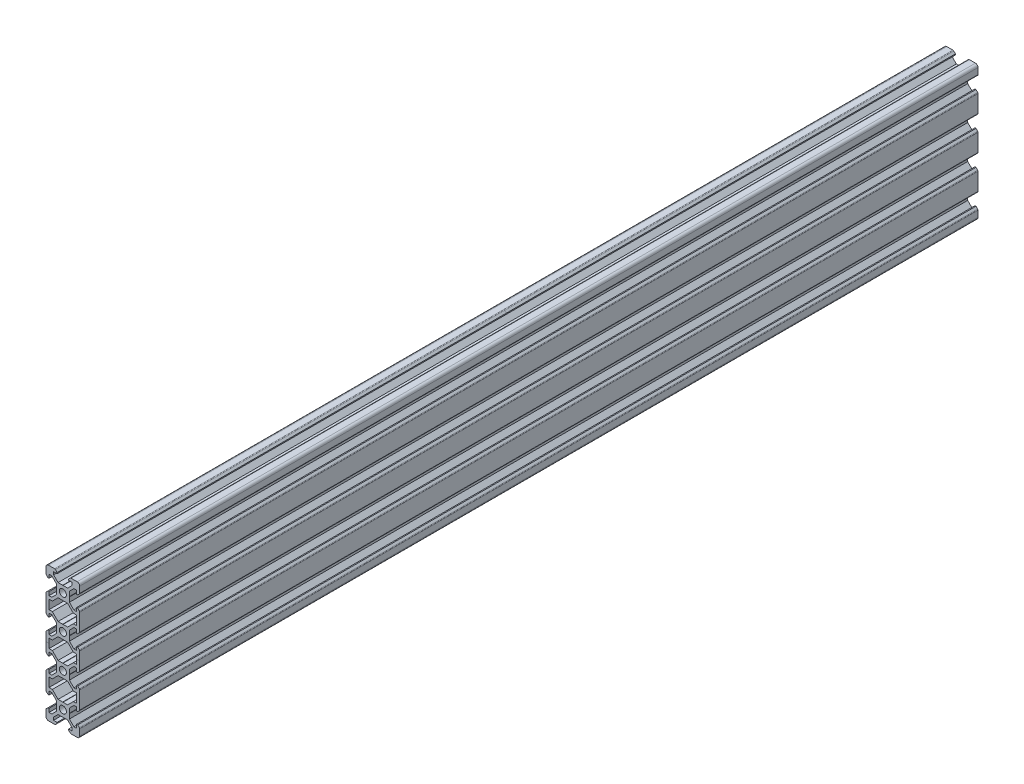
from build123d import *

# Parameters (mm, degrees)
SKETCH1_R           = 2.1
BOSS_EXTRUDE2_DEPTH = 533


with BuildPart() as part:
    # Sketch1 → Boss-Extrude2 (new body)
    with BuildSketch(Plane.XY):
        with BuildLine():
            Line((-8.5, 10), (-4.862792737, 10))
            ThreePointArc((-4.862792737, 10), (-4.598292737, 9.947387679), (-4.374060464, 9.797560464))
            Line((-4.374060464, 9.797560464), (-3.3865, 8.81))
            Line((-3.3865, 8.81), (-3.3865, 8.2))
            Line((-3.3865, 8.2), (-5.5, 8.2))
            Line((-5.5, 8.2), (-5.5, 6.561))
            Line((-5.5, 6.561), (-2.8395, 3.9005))
            Line((-2.8395, 3.9005), (-0.1, 3.9005))
            Line((-0.1, 3.9005), (0, 3.8005))
            Line((0, 3.8005), (0.1, 3.9005))
            Line((0.1, 3.9005), (2.8395, 3.9005))
            Line((2.8395, 3.9005), (5.5, 6.561))
            Line((5.5, 6.561), (5.5, 8.2))
            Line((5.5, 8.2), (3.3865, 8.2))
            Line((3.3865, 8.2), (3.3865, 8.81))
            Line((3.3865, 8.81), (4.374060464, 9.797560464))
            ThreePointArc((4.374060464, 9.797560464), (4.598292737, 9.947387679), (4.862792737, 10))
            Line((4.862792737, 10), (8.5, 10))
            ThreePointArc((8.5, 10), (9.560660172, 9.560660172), (10, 8.5))
            Line((10, 8.5), (10, 4.862792737))
            ThreePointArc((10, 4.862792737), (9.947387679, 4.598292737), (9.797560464, 4.374060464))
            Line((9.797560464, 4.374060464), (8.81, 3.3865))
            Line((8.81, 3.3865), (8.2, 3.3865))
            Line((8.2, 3.3865), (8.2, 5.5))
            Line((8.2, 5.5), (6.561, 5.5))
            Line((6.561, 5.5), (3.9005, 2.8395))
            Line((3.9005, 2.8395), (3.9005, 0.1))
            Line((3.9005, 0.1), (3.8005, 0))
            Line((3.8005, 0), (3.9005, -0.1))
            Line((3.9005, -0.1), (3.9005, -2.8395))
            Line((3.9005, -2.8395), (6.561, -5.5))
            Line((6.561, -5.5), (8.2, -5.5))
            Line((8.2, -5.5), (8.2, -3.3865))
            Line((8.2, -3.3865), (8.81, -3.3865))
            Line((8.81, -3.3865), (9.797560464, -4.374060464))
            ThreePointArc((9.797560464, -4.374060464), (9.947387679, -4.598292737), (10, -4.862792737))
            Line((10, -4.862792737), (10, -15.137207263))
            ThreePointArc((10, -15.137207263), (9.947387679, -15.401707263), (9.797560464, -15.625939536))
            Line((9.797560464, -15.625939536), (8.81, -16.6135))
            Line((8.81, -16.6135), (8.2, -16.6135))
            Line((8.2, -16.6135), (8.2, -14.5))
            Line((8.2, -14.5), (6.561, -14.5))
            Line((6.561, -14.5), (3.9005, -17.1605))
            Line((3.9005, -17.1605), (3.9005, -19.9))
            Line((3.9005, -19.9), (3.8005, -20))
            Line((3.8005, -20), (3.9005, -20.1))
            Line((3.9005, -20.1), (3.9005, -22.8395))
            Line((3.9005, -22.8395), (6.561, -25.5))
            Line((6.561, -25.5), (8.2, -25.5))
            Line((8.2, -25.5), (8.2, -23.3865))
            Line((8.2, -23.3865), (8.81, -23.3865))
            Line((8.81, -23.3865), (9.797560464, -24.374060464))
            ThreePointArc((9.797560464, -24.374060464), (9.947387679, -24.598292737), (10, -24.862792737))
            Line((10, -24.862792737), (10, -35.137207263))
            ThreePointArc((10, -35.137207263), (9.947387679, -35.401707263), (9.797560464, -35.625939536))
            Line((9.797560464, -35.625939536), (8.81, -36.6135))
            Line((8.81, -36.6135), (8.2, -36.6135))
            Line((8.2, -36.6135), (8.2, -34.5))
            Line((8.2, -34.5), (6.561, -34.5))
            Line((6.561, -34.5), (3.9005, -37.1605))
            Line((3.9005, -37.1605), (3.9005, -39.9))
            Line((3.9005, -39.9), (3.8005, -40))
            Line((3.8005, -40), (3.9005, -40.1))
            Line((3.9005, -40.1), (3.9005, -42.8395))
            Line((3.9005, -42.8395), (6.561, -45.5))
            Line((6.561, -45.5), (8.2, -45.5))
            Line((8.2, -45.5), (8.2, -43.3865))
            Line((8.2, -43.3865), (8.81, -43.3865))
            Line((8.81, -43.3865), (9.797560464, -44.374060464))
            ThreePointArc((9.797560464, -44.374060464), (9.947387679, -44.598292737), (10, -44.862792737))
            Line((10, -44.862792737), (10, -55.137207263))
            ThreePointArc((10, -55.137207263), (9.947387679, -55.401707263), (9.797560464, -55.625939536))
            Line((9.797560464, -55.625939536), (8.81, -56.6135))
            Line((8.81, -56.6135), (8.2, -56.6135))
            Line((8.2, -56.6135), (8.2, -54.5))
            Line((8.2, -54.5), (6.561, -54.5))
            Line((6.561, -54.5), (3.9005, -57.1605))
            Line((3.9005, -57.1605), (3.9005, -59.9))
            Line((3.9005, -59.9), (3.8005, -60))
            Line((3.8005, -60), (3.9005, -60.1))
            Line((3.9005, -60.1), (3.9005, -62.8395))
            Line((3.9005, -62.8395), (6.561, -65.5))
            Line((6.561, -65.5), (8.2, -65.5))
            Line((8.2, -65.5), (8.2, -63.3865))
            Line((8.2, -63.3865), (8.81, -63.3865))
            Line((8.81, -63.3865), (9.797560464, -64.374060464))
            ThreePointArc((9.797560464, -64.374060464), (9.947387679, -64.598292737), (10, -64.862792737))
            Line((10, -64.862792737), (10, -68.5))
            ThreePointArc((10, -68.5), (9.560660172, -69.560660172), (8.5, -70))
            Line((8.5, -70), (4.862792737, -70))
            ThreePointArc((4.862792737, -70), (4.598292737, -69.947387679), (4.374060464, -69.797560464))
            Line((4.374060464, -69.797560464), (3.3865, -68.81))
            Line((3.3865, -68.81), (3.3865, -68.2))
            Line((3.3865, -68.2), (5.5, -68.2))
            Line((5.5, -68.2), (5.5, -66.561))
            Line((5.5, -66.561), (2.8395, -63.9005))
            Line((2.8395, -63.9005), (0.1, -63.9005))
            Line((0.1, -63.9005), (0, -63.8005))
            Line((0, -63.8005), (-0.1, -63.9005))
            Line((-0.1, -63.9005), (-2.8395, -63.9005))
            Line((-2.8395, -63.9005), (-5.5, -66.561))
            Line((-5.5, -66.561), (-5.5, -68.2))
            Line((-5.5, -68.2), (-3.3865, -68.2))
            Line((-3.3865, -68.2), (-3.3865, -68.81))
            Line((-3.3865, -68.81), (-4.374060464, -69.797560464))
            ThreePointArc((-4.374060464, -69.797560464), (-4.598292737, -69.947387679), (-4.862792737, -70))
            Line((-4.862792737, -70), (-8.5, -70))
            ThreePointArc((-8.5, -70), (-9.560660172, -69.560660172), (-10, -68.5))
            Line((-10, -68.5), (-10, -64.862792737))
            ThreePointArc((-10, -64.862792737), (-9.947387679, -64.598292737), (-9.797560464, -64.374060464))
            Line((-9.797560464, -64.374060464), (-8.81, -63.3865))
            Line((-8.81, -63.3865), (-8.2, -63.3865))
            Line((-8.2, -63.3865), (-8.2, -65.5))
            Line((-8.2, -65.5), (-6.561, -65.5))
            Line((-6.561, -65.5), (-3.9005, -62.8395))
            Line((-3.9005, -62.8395), (-3.9005, -60.1))
            Line((-3.9005, -60.1), (-3.8005, -60))
            Line((-3.8005, -60), (-3.9005, -59.9))
            Line((-3.9005, -59.9), (-3.9005, -57.1605))
            Line((-3.9005, -57.1605), (-6.561, -54.5))
            Line((-6.561, -54.5), (-8.2, -54.5))
            Line((-8.2, -54.5), (-8.2, -56.6135))
            Line((-8.2, -56.6135), (-8.81, -56.6135))
            Line((-8.81, -56.6135), (-9.797560464, -55.625939536))
            ThreePointArc((-9.797560464, -55.625939536), (-9.947387679, -55.401707263), (-10, -55.137207263))
            Line((-10, -55.137207263), (-10, -44.862792737))
            ThreePointArc((-10, -44.862792737), (-9.947387679, -44.598292737), (-9.797560464, -44.374060464))
            Line((-9.797560464, -44.374060464), (-8.81, -43.3865))
            Line((-8.81, -43.3865), (-8.2, -43.3865))
            Line((-8.2, -43.3865), (-8.2, -45.5))
            Line((-8.2, -45.5), (-6.561, -45.5))
            Line((-6.561, -45.5), (-3.9005, -42.8395))
            Line((-3.9005, -42.8395), (-3.9005, -40.1))
            Line((-3.9005, -40.1), (-3.8005, -40))
            Line((-3.8005, -40), (-3.9005, -39.9))
            Line((-3.9005, -39.9), (-3.9005, -37.1605))
            Line((-3.9005, -37.1605), (-6.561, -34.5))
            Line((-6.561, -34.5), (-8.2, -34.5))
            Line((-8.2, -34.5), (-8.2, -36.6135))
            Line((-8.2, -36.6135), (-8.81, -36.6135))
            Line((-8.81, -36.6135), (-9.797560464, -35.625939536))
            ThreePointArc((-9.797560464, -35.625939536), (-9.947387679, -35.401707263), (-10, -35.137207263))
            Line((-10, -35.137207263), (-10, -24.862792737))
            ThreePointArc((-10, -24.862792737), (-9.947387679, -24.598292737), (-9.797560464, -24.374060464))
            Line((-9.797560464, -24.374060464), (-8.81, -23.3865))
            Line((-8.81, -23.3865), (-8.2, -23.3865))
            Line((-8.2, -23.3865), (-8.2, -25.5))
            Line((-8.2, -25.5), (-6.561, -25.5))
            Line((-6.561, -25.5), (-3.9005, -22.8395))
            Line((-3.9005, -22.8395), (-3.9005, -20.1))
            Line((-3.9005, -20.1), (-3.8005, -20))
            Line((-3.8005, -20), (-3.9005, -19.9))
            Line((-3.9005, -19.9), (-3.9005, -17.1605))
            Line((-3.9005, -17.1605), (-6.561, -14.5))
            Line((-6.561, -14.5), (-8.2, -14.5))
            Line((-8.2, -14.5), (-8.2, -16.6135))
            Line((-8.2, -16.6135), (-8.81, -16.6135))
            Line((-8.81, -16.6135), (-9.797560464, -15.625939536))
            ThreePointArc((-9.797560464, -15.625939536), (-9.947387679, -15.401707263), (-10, -15.137207263))
            Line((-10, -15.137207263), (-10, -4.862792737))
            ThreePointArc((-10, -4.862792737), (-9.947387679, -4.598292737), (-9.797560464, -4.374060464))
            Line((-9.797560464, -4.374060464), (-8.81, -3.3865))
            Line((-8.81, -3.3865), (-8.2, -3.3865))
            Line((-8.2, -3.3865), (-8.2, -5.5))
            Line((-8.2, -5.5), (-6.561, -5.5))
            Line((-6.561, -5.5), (-3.9005, -2.8395))
            Line((-3.9005, -2.8395), (-3.9005, -0.1))
            Line((-3.9005, -0.1), (-3.8005, 0))
            Line((-3.8005, 0), (-3.9005, 0.1))
            Line((-3.9005, 0.1), (-3.9005, 2.8395))
            Line((-3.9005, 2.8395), (-6.561, 5.5))
            Line((-6.561, 5.5), (-8.2, 5.5))
            Line((-8.2, 5.5), (-8.2, 3.3865))
            Line((-8.2, 3.3865), (-8.81, 3.3865))
            Line((-8.81, 3.3865), (-9.797560464, 4.374060464))
            ThreePointArc((-9.797560464, 4.374060464), (-9.947387679, 4.598292737), (-10, 4.862792737))
            Line((-10, 4.862792737), (-10, 8.5))
            ThreePointArc((-10, 8.5), (-9.560660172, 9.560660172), (-8.5, 10))
        make_face()
        Circle(SKETCH1_R, mode=Mode.SUBTRACT)
        with Locations((0, -20)):
            Circle(SKETCH1_R, mode=Mode.SUBTRACT)
        with Locations(Location((0, -40, 0), (0, 0, 180))):
            Circle(SKETCH1_R, mode=Mode.SUBTRACT)
        with Locations(Location((0, -60, 0), (0, 0, 180))):
            Circle(SKETCH1_R, mode=Mode.SUBTRACT)
        Polygon((-8.2, -12.7), (-8.2, -7.3), (-6.239, -7.3), (-5.5, -6.561), (-2.8395, -3.9005), (-0.1, -3.9005), (0, -3.8005), (0.1, -3.9005), (2.8395, -3.9005), (5.5, -6.561), (6.239, -7.3), (8.2, -7.3), (8.2, -12.7), (6.239, -12.7), (5.5, -13.439), (2.8395, -16.0995), (0.1, -16.0995), (0, -16.1995), (-0.1, -16.0995), (-2.8395, -16.0995), (-5.5, -13.439), (-6.239, -12.7), align=None, mode=Mode.SUBTRACT)
        Polygon((2.8395, -23.9005), (5.5, -26.561), (6.239, -27.3), (8.2, -27.3), (8.2, -32.7), (6.239, -32.7), (5.5, -33.439), (2.8395, -36.0995), (0.1, -36.0995), (0, -36.1995), (-0.1, -36.0995), (-2.8395, -36.0995), (-5.5, -33.439), (-6.239, -32.7), (-8.2, -32.7), (-8.2, -27.3), (-6.239, -27.3), (-5.5, -26.561), (-2.8395, -23.9005), (-0.1, -23.9005), (0, -23.8005), (0.1, -23.9005), align=None, mode=Mode.SUBTRACT)
        Polygon((-0.1, -56.0995), (0, -56.1995), (0.1, -56.0995), (2.8395, -56.0995), (5.5, -53.439), (6.239, -52.7), (8.2, -52.7), (8.2, -47.3), (6.239, -47.3), (5.5, -46.561), (2.8395, -43.9005), (0.1, -43.9005), (0, -43.8005), (-0.1, -43.9005), (-2.8395, -43.9005), (-5.5, -46.561), (-6.239, -47.3), (-8.2, -47.3), (-8.2, -52.7), (-6.239, -52.7), (-5.5, -53.439), (-2.8395, -56.0995), align=None, mode=Mode.SUBTRACT)
    extrude(amount=BOSS_EXTRUDE2_DEPTH)


solid = part.part
